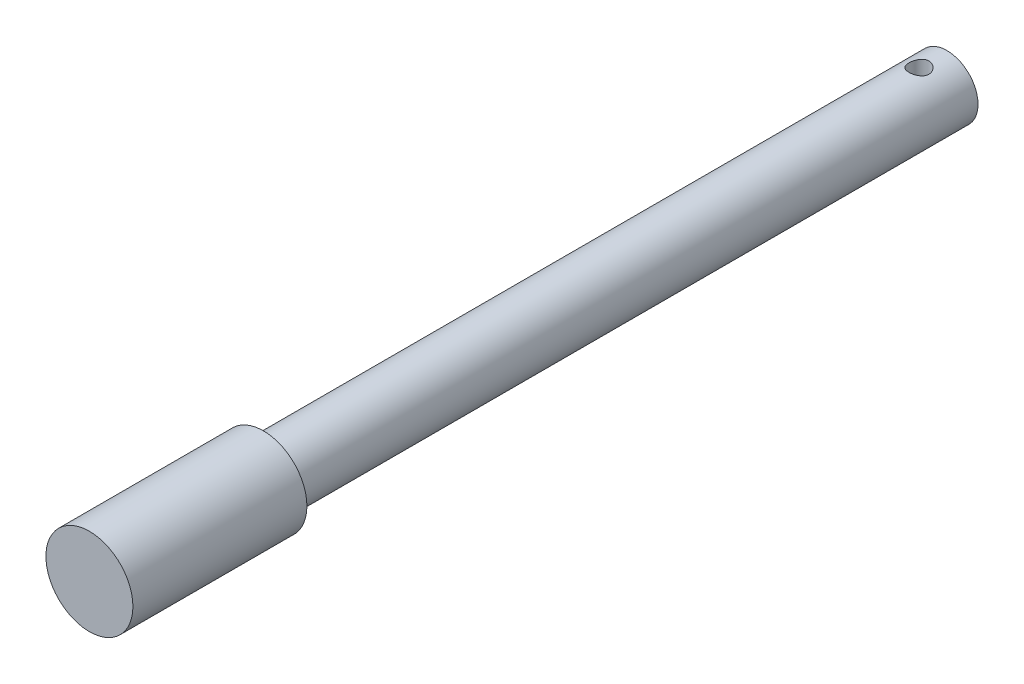
from build123d import *

# Parameters (mm, degrees)
SKETCH1_R               = 10
BOSS_EXTRUDE1_DEPTH     = 276
SKETCH2_R               = 14
BOSS_EXTRUDE2_DEPTH     = 56
CUT_EXTRUDE1_DEPTH      = 56
CUT_EXTRUDE1_DEPTH_BACK = 56
SKETCH3_R               = 3.2


with BuildPart() as part:
    # Sketch1 → Boss-Extrude1 (new body)
    with BuildSketch(Plane.XY):
        Circle(SKETCH1_R)
    extrude(amount=BOSS_EXTRUDE1_DEPTH)

    # Sketch2 → Boss-Extrude2 (add)
    with BuildSketch(Plane.XY.offset(276)):
        Circle(SKETCH2_R)
    extrude(amount=-BOSS_EXTRUDE2_DEPTH)

    # Sketch3 → Cut-Extrude1 (cut, two sides: drawn at the far end of the back side and taken through both)
    with BuildSketch(Plane(origin=(0, 0, 0), x_dir=(1, 0, 0), z_dir=(0, 1, 0)).offset(-CUT_EXTRUDE1_DEPTH_BACK)):
        with Locations((0, -9)):
            Circle(SKETCH3_R)
    extrude(amount=CUT_EXTRUDE1_DEPTH + CUT_EXTRUDE1_DEPTH_BACK, mode=Mode.SUBTRACT)


solid = part.part
